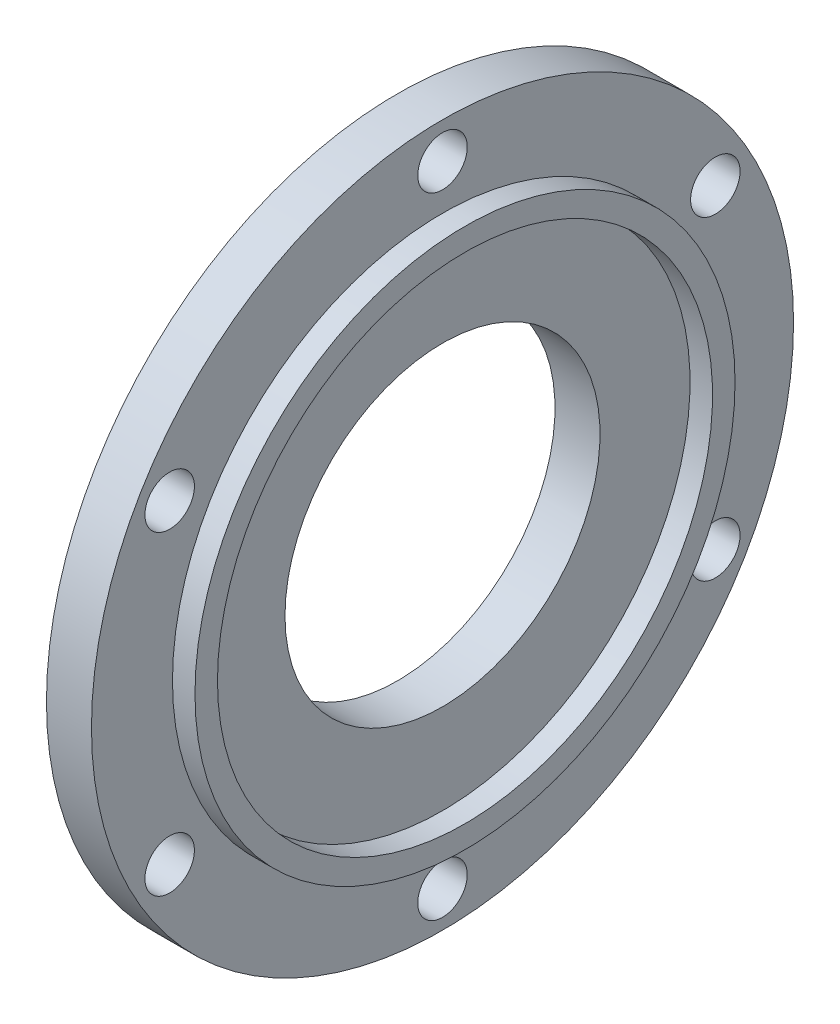
from build123d import *

# Parameters (mm, degrees)
SKETCH2_R          = 5.5
CUT_EXTRUDE1_DEPTH = 10
CIRPATTERN1_COUNT  = 6


with BuildPart() as part:
    # Sketch1 → Revolve1 (revolve)
    with BuildSketch(Plane.XY, mode=Mode.PRIVATE) as revolve1_sk:
        Polygon((0, 78), (0, 35), (10, 35), (10, 55), (15, 55), (15, 60), (10, 60), (10, 78), align=None)
    revolve(revolve1_sk.sketch.rotate(Axis((0, 0, 0), (1, 0, 0)), 90), axis=Axis((0, 0, 0), (1, 0, 0)))

    # Sketch2 → Cut-Extrude1 (cut)
    with BuildSketch(Plane(origin=(10, 0, 0), x_dir=(0, 0, -1), z_dir=(1, 0, 0))):
        with Locations((60.621778265, 35)):
            Circle(SKETCH2_R)
    cut_extrude1 = extrude(amount=-CUT_EXTRUDE1_DEPTH, mode=Mode.SUBTRACT)

    # CirPattern1: Cut-Extrude1 ×6 about axis
    cirpattern1_axis = Axis((0, 0, 0), (1, 0, 0))
    for i in range(1, CIRPATTERN1_COUNT):
        add(cut_extrude1.rotate(cirpattern1_axis, i * 360 / CIRPATTERN1_COUNT), mode=Mode.SUBTRACT)


solid = part.part
